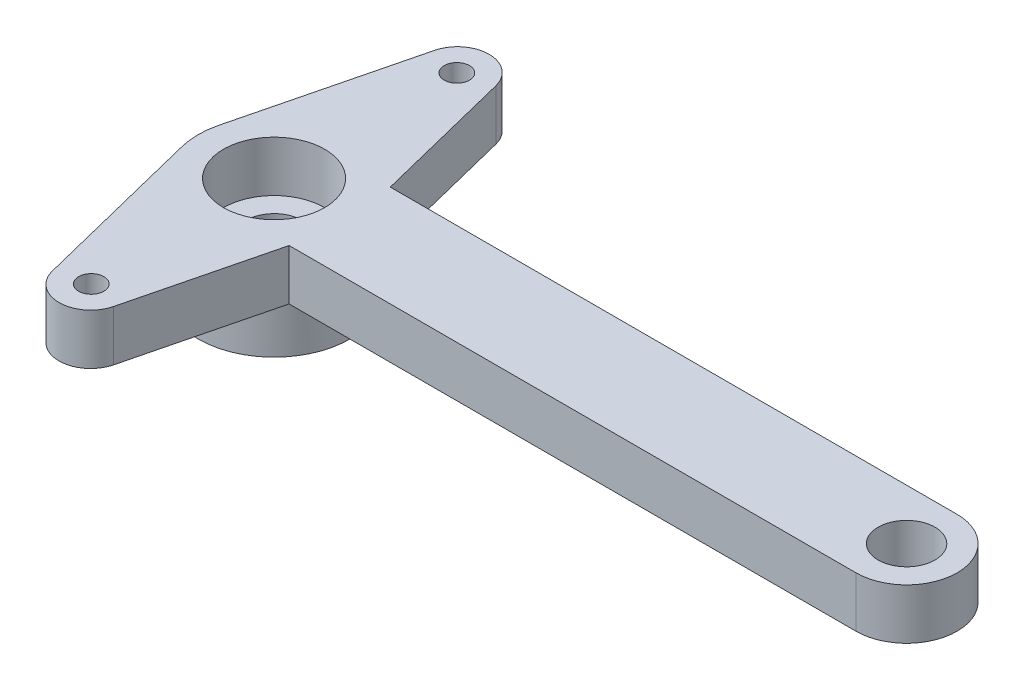
from build123d import *

# Parameters (mm, degrees)
SKETCH1_R           = 2.25
BOSS_EXTRUDE1_DEPTH = 8
SKETCH2_R           = 1
CUT_EXTRUDE1_DEPTH  = 10
SKETCH3_W           = 12
SKETCH3_H           = 4
SKETCH4_R           = 2.25
BOSS_EXTRUDE2_DEPTH = 4
SKETCH5_R           = 4
CUT_EXTRUDE2_DEPTH  = 4


with BuildPart() as part:
    # Sketch1 → Boss-Extrude1 (new body)
    with BuildSketch(Plane(origin=(0, 0, 0), x_dir=(1, 0, 0), z_dir=(0, 1, 0))):
        with BuildLine():
            Line((-5.822585081, 1.448275862), (-2.426077117, 15.103448276))
            ThreePointArc((-2.426077117, 15.103448276), (0, 17), (2.426077117, 15.103448276))
            Line((2.426077117, 15.103448276), (5.822585081, 1.448275862))
            ThreePointArc((5.822585081, 1.448275862), (6, 0), (5.822585081, -1.448275862))
            Line((5.822585081, -1.448275862), (2.426077117, -15.103448276))
            ThreePointArc((2.426077117, -15.103448276), (0, -17), (-2.426077117, -15.103448276))
            Line((-2.426077117, -15.103448276), (-5.822585081, -1.448275862))
            ThreePointArc((-5.822585081, -1.448275862), (-6, 0), (-5.822585081, 1.448275862))
        make_face()
        with Locations(Location((0, 0, 0), (0, 0, 270))):
            Circle(SKETCH1_R, mode=Mode.SUBTRACT)
    extrude(amount=BOSS_EXTRUDE1_DEPTH)

    # Sketch2 → Cut-Extrude1 (cut)
    with BuildSketch(Plane.XZ):
        with Locations(Location((0, -14.45, 0), (0, 0, 270))):
            Circle(SKETCH2_R)
        with Locations(Location((0, 14.45, 0), (0, 0, 90))):
            Circle(SKETCH2_R)
    extrude(amount=-CUT_EXTRUDE1_DEPTH, mode=Mode.SUBTRACT)

    # Sketch3 → Cut-Revolve1 (revolve, cut)
    with BuildSketch(Plane(origin=(0, 0, 0), x_dir=(0, 0, -1), z_dir=(1, 0, 0)), mode=Mode.PRIVATE) as cut_revolve1_sk:
        with Locations((12, 2)):
            Rectangle(SKETCH3_W, SKETCH3_H)
    revolve(cut_revolve1_sk.sketch.rotate(Axis((0, 0, 0), (0, 1, 0)), 76.032037325), axis=Axis((0, 0, 0), (0, 1, 0)), mode=Mode.SUBTRACT)

    # Sketch4 → Boss-Extrude2 (add)
    with BuildSketch(Plane(origin=(0, 8, 0), x_dir=(1, 0, 0), z_dir=(0, 1, 0))):
        with BuildLine():
            Line((50, 4), (5.187884098, 4))
            Line((5.187884098, 4), (5.187884098, -4))
            Line((5.187884098, -4), (50, -4))
            ThreePointArc((50, -4), (54, 0), (50, 4))
        make_face()
        with Locations(Location((50, 0, 0), (0, 0, 270))):
            Circle(SKETCH4_R, mode=Mode.SUBTRACT)
    extrude(amount=-BOSS_EXTRUDE2_DEPTH)

    # Sketch5 → Cut-Extrude2 (cut)
    with BuildSketch(Plane(origin=(0, 8, 0), x_dir=(1, 0, 0), z_dir=(0, 1, 0))):
        with Locations(Location((0, 0, 0), (0, 0, 270))):
            Circle(SKETCH5_R)
    extrude(amount=-CUT_EXTRUDE2_DEPTH, mode=Mode.SUBTRACT)


solid = part.part
